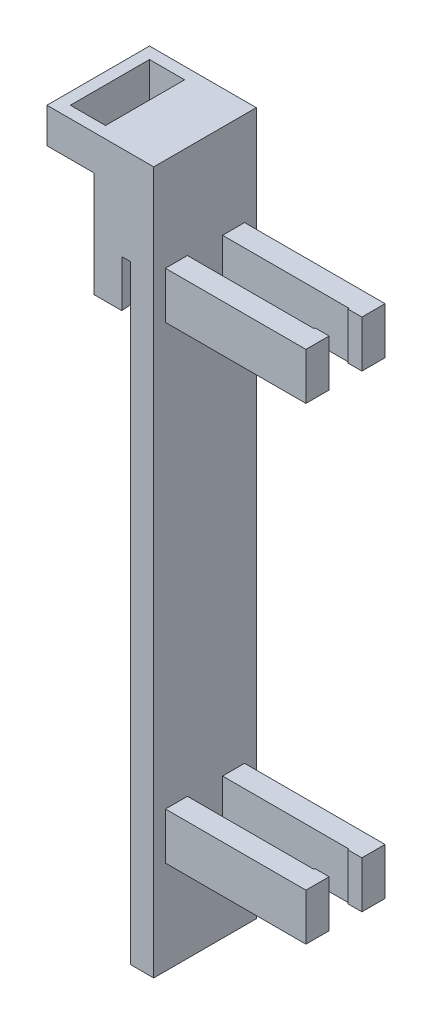
from build123d import *

# Parameters (mm, degrees)
BOSS_EXTRUDE1_DEPTH      = 21.9
SKETCH2_W                = 4.7
SKETCH2_H                = 10
BOSS_EXTRUDE2_DEPTH      = 30
SKETCH3_W                = 5
SKETCH3_H                = 21.9
BOSS_EXTRUDE3_DEPTH      = 120
SKETCH4_W                = 3
SKETCH4_H                = 10
BOSS_EXTRUDE4_DEPTH      = 0.25
SKETCH5_W                = 3
SKETCH5_H                = 10
BOSS_EXTRUDE5_DEPTH      = 0.25
CORTE_EXTRUS_O1_DEPTH    = 10
ESBO_O3_W                = 21.9
ESBO_O3_H                = 7.5
RESSALTO_EXTRUS_O2_DEPTH = 10
ESBO_O4_W                = 7.5
ESBO_O4_H                = 16.9
CORTE_EXTRUS_O2_DEPTH    = 10
PADR_O_LINEAR1_COUNT     = 2
PADR_O_LINEAR1_PITCH     = 100


with BuildPart() as part:
    # Sketch1 → Boss-Extrude1 (new body)
    with BuildSketch(Plane.XY):
        Polygon((0, 0), (0, 30), (12.8, 30), (12.8, 0), (7.8, 0), (7.8, 10), (6, 10), (6, 0), align=None)
    extrude(amount=BOSS_EXTRUDE1_DEPTH)

    # Sketch2 → Boss-Extrude2 (add)
    with BuildSketch(Plane(origin=(12.8, 0, 0), x_dir=(0, 0, -1), z_dir=(1, 0, 0))):
        with Locations((-17.05, 5)):
            Rectangle(SKETCH2_W, SKETCH2_H)
        with Locations((-4.85, 5)):
            Rectangle(SKETCH2_W, SKETCH2_H)
    boss_extrude2 = extrude(amount=BOSS_EXTRUDE2_DEPTH)

    # Sketch3 → Boss-Extrude3 (add)
    with BuildSketch(Plane.XZ):
        with Locations((10.3, 10.95)):
            Rectangle(SKETCH3_W, SKETCH3_H)
    extrude(amount=BOSS_EXTRUDE3_DEPTH)

    # Sketch4 → Boss-Extrude4 (add)
    with BuildSketch(Plane(origin=(0, 0, 14.7), x_dir=(-1, 0, 0), z_dir=(0, 0, -1))):
        with Locations((-41.3, 5)):
            Rectangle(SKETCH4_W, SKETCH4_H)
    boss_extrude4 = extrude(amount=BOSS_EXTRUDE4_DEPTH)

    # Sketch5 → Boss-Extrude5 (add)
    with BuildSketch(Plane.XY.offset(7.2)):
        with Locations((41.3, 5)):
            Rectangle(SKETCH5_W, SKETCH5_H)
    boss_extrude5 = extrude(amount=BOSS_EXTRUDE5_DEPTH)

    # Esboço2 → Corte-extrusão1 (cut)
    with BuildSketch(Plane.XZ):
        with BuildLine():
            Line((6, 21.9), (6, 0))
            ThreePointArc((6, 0), (5.377380148, 10.95), (6, 21.9))
        make_face()
    extrude(amount=-CORTE_EXTRUS_O1_DEPTH, mode=Mode.SUBTRACT)

    # Esboço3 → Ressalto-extrusão2 (add)
    with BuildSketch(Plane.ZY):
        with Locations((10.95, 26.25)):
            Rectangle(ESBO_O3_W, ESBO_O3_H)
    extrude(amount=RESSALTO_EXTRUS_O2_DEPTH)

    # Esboço4 → Corte-extrusão2 (cut)
    with BuildSketch(Plane.XZ.offset(-22.5)):
        with Locations((-3.75, 10.95)):
            Rectangle(ESBO_O4_W, ESBO_O4_H)
    extrude(amount=-CORTE_EXTRUS_O2_DEPTH, mode=Mode.SUBTRACT)

    # Padrão linear1: Boss-Extrude2, Boss-Extrude4, Boss-Extrude5 ×2
    with Locations(*[(0, -i * PADR_O_LINEAR1_PITCH, 0) for i in range(1, PADR_O_LINEAR1_COUNT)]):
        add(boss_extrude2)
        add(boss_extrude4)
        add(boss_extrude5)


solid = part.part
